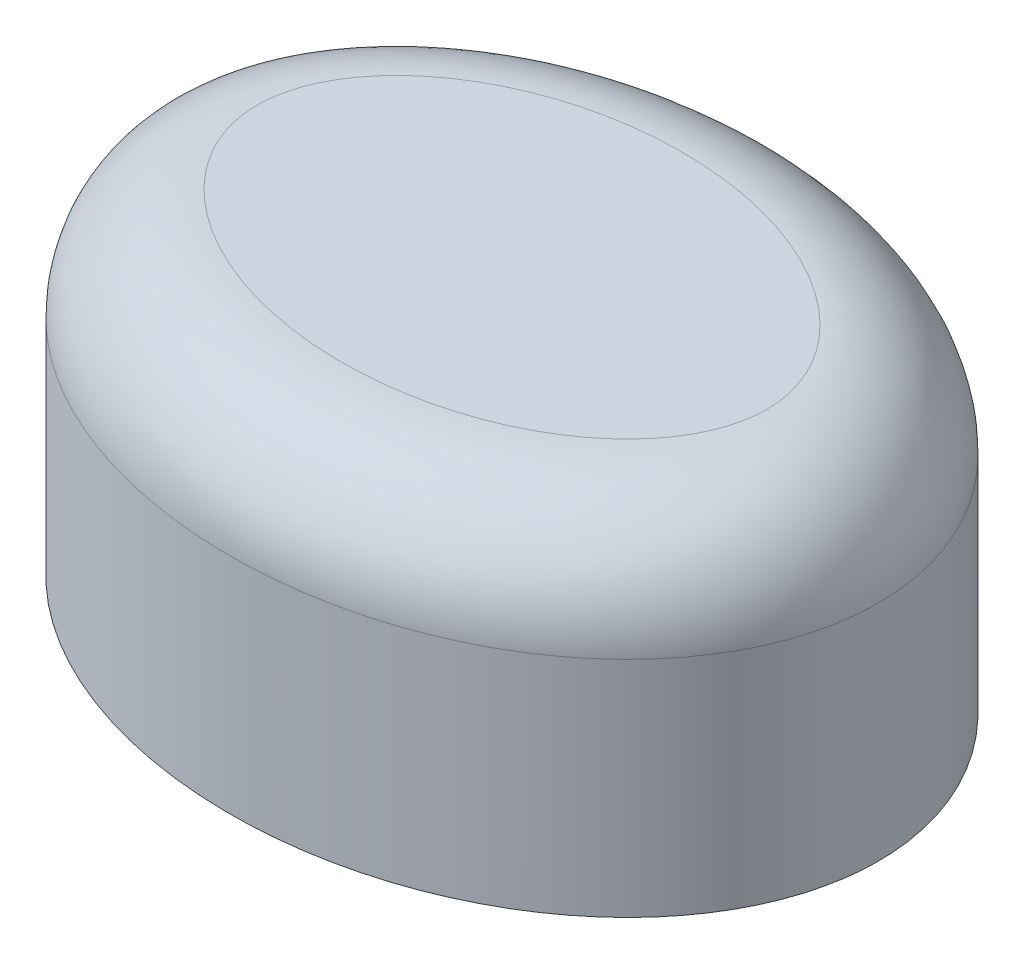
from build123d import *

# Parameters (mm, degrees)
SKIZZE4_RX                      = 33.193833254
SKIZZE4_RY                      = 25.753135841
AUFSATZ_LINEAR_AUSTRAGEN2_DEPTH = 30
VERRUNDUNG4_R                   = 10


with BuildPart() as part:
    # Skizze4 → Aufsatz-Linear austragen2 (new body)
    with BuildSketch(Plane(origin=(0, 0, 0), x_dir=(1, 0, 0), z_dir=(0, 1, 0))):
        with Locations(Location((0, 0), (0, 0, -1.701967181))):
            Ellipse(SKIZZE4_RX, SKIZZE4_RY)
    extrude(amount=AUFSATZ_LINEAR_AUSTRAGEN2_DEPTH)

    # Verrundung4
    verrundung4_edges = [part.edges().sort_by_distance(p)[0] for p in [
        (-33.179368226, 30, -0.979829594),
    ]]
    fillet(verrundung4_edges, radius=VERRUNDUNG4_R)


solid = part.part
